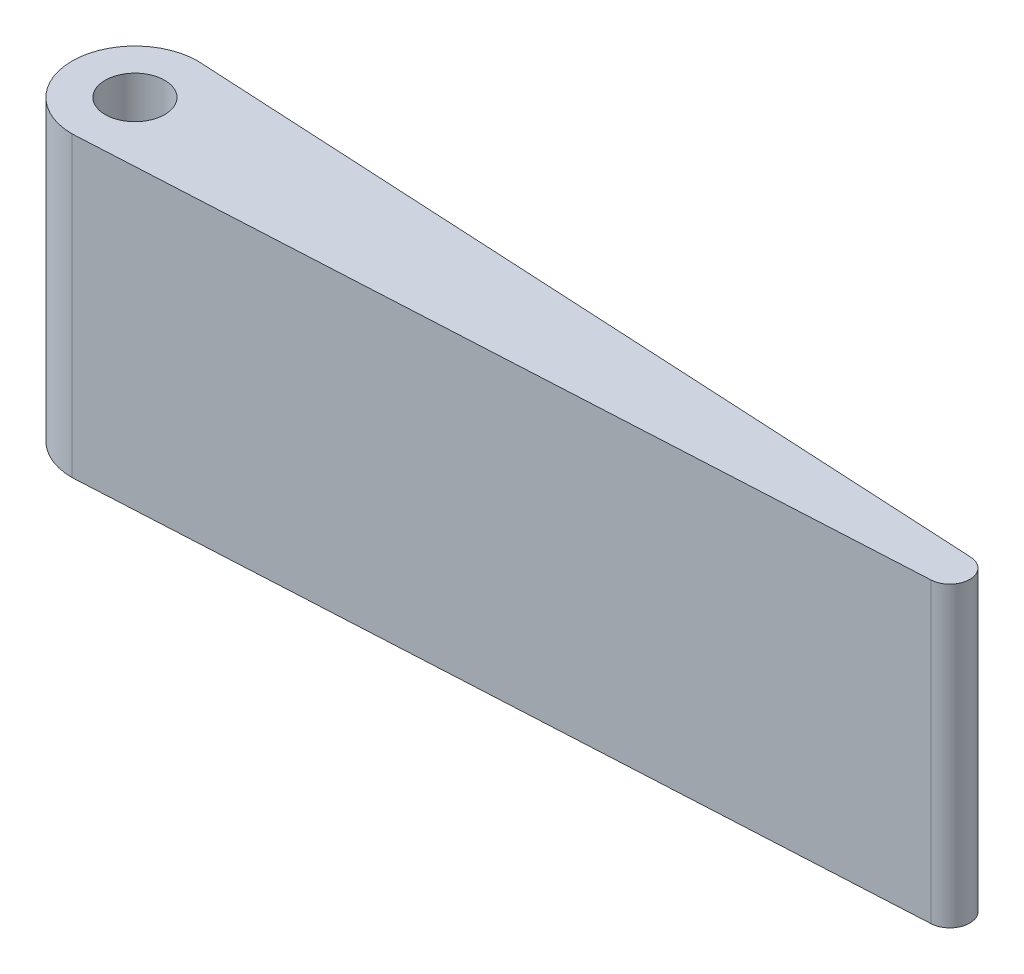
from build123d import *

# Parameters (mm, degrees)
SKETCH1_R           = 3
BOSS_EXTRUDE1_DEPTH = 30
FILLET1_R           = 2


with BuildPart() as part:
    # Sketch1 → Boss-Extrude1 (new body)
    with BuildSketch(Plane(origin=(0, 0, 0), x_dir=(1, 0, 0), z_dir=(0, 1, 0))):
        with BuildLine():
            Line((120, 0), (-0.016209805, 6.346913517))
            ThreePointArc((-0.016209805, 6.346913517), (-6.346913517, -0.016209805), (0.016209805, -6.346913517))
            Line((0.016209805, -6.346913517), (120, 0))
        make_face()
        with Locations(Location((0, 0, 0), (0, 0, 270))):
            Circle(SKETCH1_R, mode=Mode.SUBTRACT)
    extrude(amount=BOSS_EXTRUDE1_DEPTH)

    # Fillet1
    fillet1_edges = [part.edges().sort_by_distance(p)[0] for p in [
        (120, 15, 0),
    ]]
    fillet(fillet1_edges, radius=FILLET1_R)


solid = part.part
